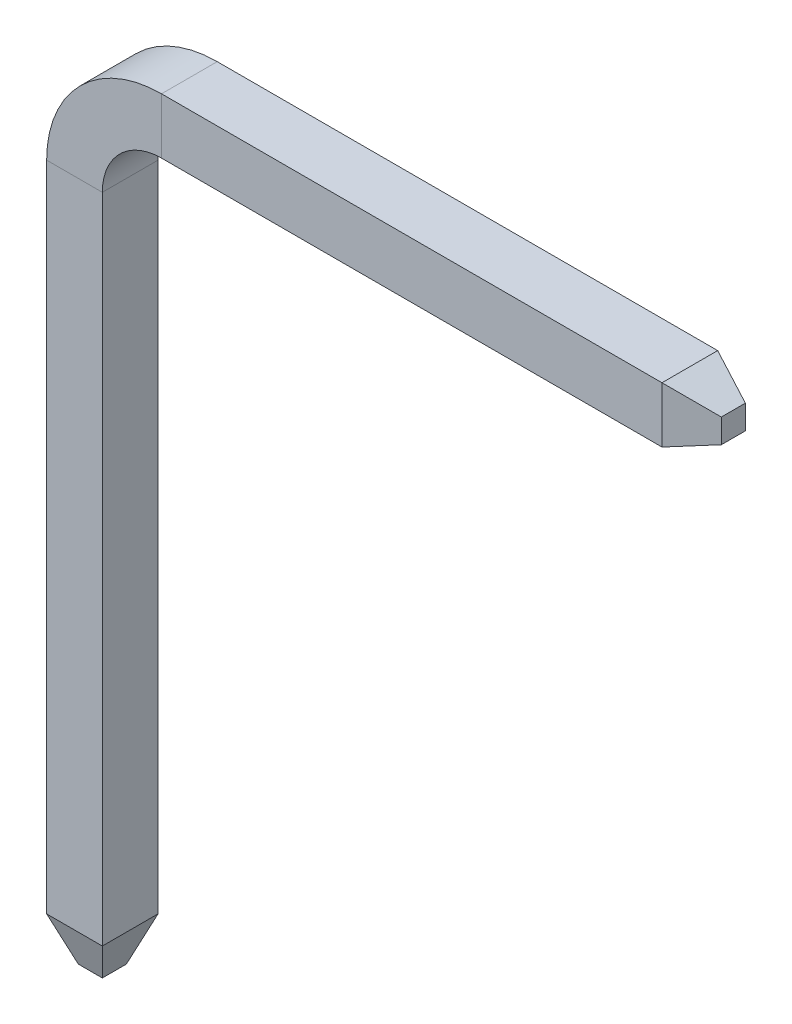
from build123d import *
from OCP.BRepFilletAPI import BRepFilletAPI_MakeChamfer

# Parameters (mm, degrees)
SKETCH_1_W      = 0.64
SKETCH_1_H      = 0.64
CHAMFER_1_SIZE  = 0.5
CHAMFER_1_SIZE2 = 0.181985117
CHAMFER_2_SIZE  = 0.5
CHAMFER_2_SIZE2 = 0.181985117


with BuildPart() as part:
    # По траектории1: sweep along a path in Эскиз2
    with BuildLine(Plane.XY) as sweep_1_path:
        Line((7.25, 4.75), (1, 4.75))
        ThreePointArc((1, 4.75), (0.292893219, 4.457106781), (0, 3.75))
        Line((0, 3.75), (0, 0))
        Line((0, 0), (0, -4.25))
    # Эскиз1 → По траектории1 (sweep)
    with BuildSketch(Plane(origin=(0, 0, 0), x_dir=(1, 0, 0), z_dir=(0, 1, 0))):
        Rectangle(SKETCH_1_W, SKETCH_1_H)
    sweep(path=sweep_1_path.line)

    # Фаска1: one chamfer whose edges measure the first distance from different faces: ONE call of the kernel's chamfer builder (chamfer() names one face for all edges)
    chamfer_1_edges_1 = [part.edges().sort_by_distance(p)[0] for p in [
        (7.25, 5.07, 0),
    ]]
    chamfer_1_side_1 = [part.faces().sort_by_distance(p)[0] for p in [
        (4.125, 5.07, 0),
    ]]
    chamfer_1_edges_2 = [part.edges().sort_by_distance(p)[0] for p in [
        (7.25, 4.75, 0.32),
    ]]
    chamfer_1_side_2 = [part.faces().sort_by_distance(p)[0] for p in [
        (4.125, 4.949930312, 0.32),
    ]]
    chamfer_1_edges_3 = [part.edges().sort_by_distance(p)[0] for p in [
        (7.25, 4.43, 0),
    ]]
    chamfer_1_side_3 = [part.faces().sort_by_distance(p)[0] for p in [
        (4.125, 4.43, 0),
    ]]
    chamfer_1_edges_4 = [part.edges().sort_by_distance(p)[0] for p in [
        (7.25, 4.75, -0.32),
    ]]
    chamfer_1_side_4 = [part.faces().sort_by_distance(p)[0] for p in [
        (4.125, 4.550069688, -0.32),
    ]]
    chamfer_1 = BRepFilletAPI_MakeChamfer(part.part.solid().wrapped)
    for e in chamfer_1_edges_1:
        chamfer_1.Add(CHAMFER_1_SIZE, CHAMFER_1_SIZE2, e.wrapped, chamfer_1_side_1[0].wrapped)  # the first distance lies on this face
    for e in chamfer_1_edges_2:
        chamfer_1.Add(CHAMFER_1_SIZE, CHAMFER_1_SIZE2, e.wrapped, chamfer_1_side_2[0].wrapped)  # the first distance lies on this face
    for e in chamfer_1_edges_3:
        chamfer_1.Add(CHAMFER_1_SIZE, CHAMFER_1_SIZE2, e.wrapped, chamfer_1_side_3[0].wrapped)  # the first distance lies on this face
    for e in chamfer_1_edges_4:
        chamfer_1.Add(CHAMFER_1_SIZE, CHAMFER_1_SIZE2, e.wrapped, chamfer_1_side_4[0].wrapped)  # the first distance lies on this face
    add(Compound.cast(chamfer_1.Shape()), mode=Mode.REPLACE)

    # Фаска2: one chamfer whose edges measure the first distance from different faces: ONE call of the kernel's chamfer builder (chamfer() names one face for all edges)
    chamfer_2_edges_1 = [part.edges().sort_by_distance(p)[0] for p in [
        (0, -4.25, 0.32),
    ]]
    chamfer_2_side_1 = [part.faces().sort_by_distance(p)[0] for p in [
        (3.875, 4.953018249, 0.32),
    ]]
    chamfer_2_edges_2 = [part.edges().sort_by_distance(p)[0] for p in [
        (0.32, -4.25, 0),
    ]]
    chamfer_2_side_2 = [part.faces().sort_by_distance(p)[0] for p in [
        (0.32, -0.25, 0),
    ]]
    chamfer_2_edges_3 = [part.edges().sort_by_distance(p)[0] for p in [
        (0, -4.25, -0.32),
    ]]
    chamfer_2_side_3 = [part.faces().sort_by_distance(p)[0] for p in [
        (3.875, 4.546981751, -0.32),
    ]]
    chamfer_2_edges_4 = [part.edges().sort_by_distance(p)[0] for p in [
        (-0.32, -4.25, 0),
    ]]
    chamfer_2_side_4 = [part.faces().sort_by_distance(p)[0] for p in [
        (-0.32, -0.25, 0),
    ]]
    chamfer_2 = BRepFilletAPI_MakeChamfer(part.part.solid().wrapped)
    for e in chamfer_2_edges_1:
        chamfer_2.Add(CHAMFER_2_SIZE, CHAMFER_2_SIZE2, e.wrapped, chamfer_2_side_1[0].wrapped)  # the first distance lies on this face
    for e in chamfer_2_edges_2:
        chamfer_2.Add(CHAMFER_2_SIZE, CHAMFER_2_SIZE2, e.wrapped, chamfer_2_side_2[0].wrapped)  # the first distance lies on this face
    for e in chamfer_2_edges_3:
        chamfer_2.Add(CHAMFER_2_SIZE, CHAMFER_2_SIZE2, e.wrapped, chamfer_2_side_3[0].wrapped)  # the first distance lies on this face
    for e in chamfer_2_edges_4:
        chamfer_2.Add(CHAMFER_2_SIZE, CHAMFER_2_SIZE2, e.wrapped, chamfer_2_side_4[0].wrapped)  # the first distance lies on this face
    add(Compound.cast(chamfer_2.Shape()), mode=Mode.REPLACE)


solid = part.part
